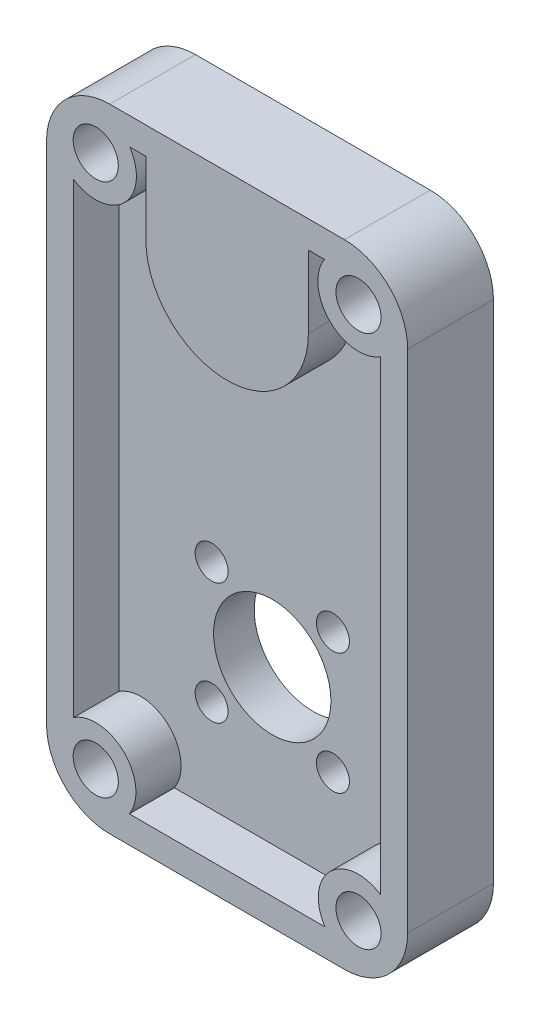
from build123d import *

# Parameters (mm, degrees)
SKETCH1_W           = 40
SKETCH1_H           = 70
SKETCH1_R           = 1.825
SKETCH1_R_2         = 6.5
BOSS_EXTRUDE1_DEPTH = 4.5
SKETCH3_W           = 40
SKETCH3_H           = 70
BOSS_EXTRUDE2_DEPTH = 5
SKETCH6_R           = 2.5
CUT_EXTRUDE3_DEPTH  = 7
SKETCH4_R           = 7
CUT_EXTRUDE1_DEPTH  = 7.5
FILLET1_R           = 7
TEXT_2804_DEPTH     = 1


with BuildPart() as part:
    # Sketch1 → Boss-Extrude1 (new body)
    with BuildSketch(Plane.XY):
        with Locations((20, 35)):
            Rectangle(SKETCH1_W, SKETCH1_H)
        with Locations((26.717514421, 13.282485579)):
            Circle(SKETCH1_R, mode=Mode.SUBTRACT)
        with Locations((26.717514421, 26.717514421)):
            Circle(SKETCH1_R, mode=Mode.SUBTRACT)
        with Locations((13.282485579, 26.717514421)):
            Circle(SKETCH1_R, mode=Mode.SUBTRACT)
        with Locations((13.282485579, 13.282485579)):
            Circle(SKETCH1_R, mode=Mode.SUBTRACT)
        with Locations((20, 20)):
            Circle(SKETCH1_R_2, mode=Mode.SUBTRACT)
    extrude(amount=BOSS_EXTRUDE1_DEPTH)

    # Sketch3 → Boss-Extrude2 (add)
    with BuildSketch(Plane.XY.offset(4.5)):
        with Locations((20, 35)):
            Rectangle(SKETCH3_W, SKETCH3_H)
        with BuildLine():
            Line((9.164835124, 3), (30.835164876, 3))
            ThreePointArc((30.835164876, 3), (31.403374824, 8.596625176), (37, 9.164835124))
            Line((37, 9.164835124), (37, 60.77541393))
            ThreePointArc((37, 60.77541393), (31.368019485, 61.368019485), (30.77541393, 67))
            Line((30.77541393, 67), (29, 67))
            Line((29, 67), (29, 59))
            ThreePointArc((29, 59), (20, 50), (11, 59))
            Line((11, 59), (11, 67))
            Line((11, 67), (9.22458607, 67))
            ThreePointArc((9.22458607, 67), (8.631980515, 61.368019485), (3, 60.77541393))
            Line((3, 60.77541393), (3, 9.164835124))
            ThreePointArc((3, 9.164835124), (8.596625176, 8.596625176), (9.164835124, 3))
        make_face(mode=Mode.SUBTRACT)
    extrude(amount=BOSS_EXTRUDE2_DEPTH)

    # Sketch6 → Cut-Extrude3 (cut)
    with BuildSketch(Plane.XY.offset(9.5)):
        with Locations((5.45, 64.55)):
            Circle(SKETCH6_R)
        with Locations((5.45, 5.45)):
            Circle(SKETCH6_R)
        with Locations((34.55, 5.45)):
            Circle(SKETCH6_R)
        with Locations((34.55, 64.55)):
            Circle(SKETCH6_R)
    extrude(amount=-CUT_EXTRUDE3_DEPTH, mode=Mode.SUBTRACT)

    # Sketch4 → Cut-Extrude1 (cut)
    with BuildSketch(Plane(origin=(0, 0, 0), x_dir=(-1, 0, 0), z_dir=(0, 0, -1))):
        with Locations((-20, 59)):
            Circle(SKETCH4_R)
    extrude(amount=-CUT_EXTRUDE1_DEPTH, mode=Mode.SUBTRACT)

    # Fillet1
    fillet1_edges = [part.edges().sort_by_distance(p)[0] for p in [
        (0, 70, 4.75),
        (40, 70, 4.75),
        (40, 0, 4.75),
        (0, 0, 4.75),
    ]]
    fillet(fillet1_edges, radius=FILLET1_R)

    # Sketch9 → Text-2804 (cut)
    # profile 1 of 4: a face of its own
    with BuildSketch(Plane(origin=(0, 0, 0), x_dir=(-1, 0, 0), z_dir=(0, 0, -1))):
        with BuildLine():
            Line((-11.980426125, 44.596523498), (-10.914320356, 44.286427345))
            add(Edge.make_bspline(
                [(-10.914320356, 44.286427345), (-10.941121501, 44.212201398), (-10.993377806, 44.067477224), (-11.090992823, 43.863360404), (-11.198202606, 43.675175785), (-11.319635477, 43.504666634), (-11.451335999, 43.349843442), (-11.597197903, 43.213418702), (-11.753396357, 43.092191437), (-11.922094381, 42.990509858), (-12.098142142, 42.906636666), (-12.279978738, 42.840895291), (-12.466472117, 42.794846874), (-12.658355143, 42.77029452), (-12.854390813, 42.762290422), (-13.055534714, 42.77678538), (-13.261286477, 42.8084484), (-13.397775761, 42.844839195), (-13.467204971, 42.863350421)],
                knots=[0, 0, 0, 0, 1.15750011, 2.25686912, 3.315794148, 4.332157814, 5.324478525, 6.29362271, 7.257957216, 8.220946452, 9.17824685, 10.115604155, 11.053938287, 11.991092726, 12.950124948, 13.928287594, 14.946163745, 16, 16, 16, 16], degree=3))
            add(Edge.make_bspline(
                [(-13.467204971, 42.863350421), (-13.551282692, 42.890632494), (-13.715534034, 42.943929814), (-13.944579077, 43.055404246), (-14.149072169, 43.19130747), (-14.331226731, 43.34746937), (-14.485491351, 43.526929537), (-14.614473349, 43.724787633), (-14.715993262, 43.941620294), (-14.787672851, 44.173161712), (-14.832596499, 44.409991215), (-14.845666141, 44.64421054), (-14.830715423, 44.872319464), (-14.795061628, 45.017963224), (-14.777301125, 45.090513883)],
                knots=[0, 0, 0, 0, 1.10520375, 2.159088023, 3.175577343, 4.170761846, 5.151802116, 6.126634874, 7.117985331, 8.137585756, 9.15240449, 10.126618192, 11.066797751, 12, 12, 12, 12], degree=3))
            add(Edge.make_bspline(
                [(-14.777301125, 45.090513883), (-14.763794427, 45.133156964), (-14.736334784, 45.219852012), (-14.684867349, 45.348348493), (-14.621207088, 45.475468904), (-14.55116938, 45.603726442), (-14.467789297, 45.729425349), (-14.378729371, 45.857589017), (-14.276712372, 45.983353663), (-14.165629164, 46.110773523), (-14.040816295, 46.239582325), (-13.898570574, 46.368436085), (-13.740265279, 46.501209968), (-13.565691194, 46.6368378), (-13.371906844, 46.772030657), (-13.16291963, 46.912030694), (-12.935968893, 47.05312752), (-12.777902225, 47.146139538), (-12.696772279, 47.193879268)],
                knots=[0, 0, 0, 0, 0.708317974, 1.440038062, 2.189212932, 2.958983779, 3.752754562, 4.576690561, 5.42991451, 6.315736775, 7.253574803, 8.268584018, 9.354000461, 10.525476643, 11.768393432, 13.095334037, 14.509139227, 16, 16, 16, 16], degree=3))
            Line((-12.696772279, 47.193879268), (-11.855426125, 47.685465806))
            Line((-11.855426125, 47.685465806), (-13.902301125, 48.280417729))
            Line((-13.902301125, 48.280417729), (-13.607829971, 49.29243696))
            Line((-13.607829971, 49.29243696), (-9.62706074, 48.13618696))
            Line((-9.62706074, 48.13618696), (-9.779704971, 47.612148498))
            Line((-9.779704971, 47.612148498), (-12.08379151, 46.315273498))
            add(Edge.make_bspline(
                [(-12.08379151, 46.315273498), (-12.150862381, 46.277496275), (-12.280077296, 46.204716832), (-12.464670632, 46.094680163), (-12.633964003, 45.989783912), (-12.787028209, 45.887450556), (-12.923882704, 45.788918368), (-13.045990625, 45.695482436), (-13.151769739, 45.605466046), (-13.269703734, 45.494265722), (-13.392584927, 45.357218894), (-13.513926046, 45.192174314), (-13.608670789, 45.028843715), (-13.647916043, 44.91534193), (-13.666724202, 44.860946575)],
                knots=[0, 0, 0, 0, 1.259574916, 2.426625201, 3.516256558, 4.518121287, 5.438744464, 6.275353076, 7.03336827, 7.710431516, 8.926712404, 10.038676673, 11.060042284, 12, 12, 12, 12], degree=3))
            add(Edge.make_bspline(
                [(-13.666724202, 44.860946575), (-13.679855555, 44.807192639), (-13.705386356, 44.702680856), (-13.704335385, 44.542747893), (-13.672781872, 44.389330911), (-13.609525549, 44.245457588), (-13.520493515, 44.114170955), (-13.401129436, 44.008130344), (-13.262217189, 43.918860263), (-13.155759648, 43.883875256), (-13.100618433, 43.865754268)],
                knots=[0, 0, 0, 0, 1.03274823, 2.007934041, 2.965681801, 3.946735693, 4.933080945, 5.909996321, 6.91745252, 8, 8, 8, 8], degree=3))
            add(Edge.make_bspline(
                [(-13.100618433, 43.865754268), (-13.071483959, 43.858415198), (-13.014479284, 43.844055533), (-12.927951069, 43.831745064), (-12.842848872, 43.829145682), (-12.758728528, 43.836951587), (-12.675925399, 43.852005672), (-12.594512064, 43.877731533), (-12.515157851, 43.913149761), (-12.436614209, 43.956212849), (-12.361795848, 44.008730195), (-12.291194923, 44.069409801), (-12.226606555, 44.138372722), (-12.165761781, 44.214137914), (-12.112208254, 44.298969091), (-12.06253528, 44.390800912), (-12.018155298, 44.49054621), (-11.993183848, 44.560688393), (-11.980426125, 44.596523498)],
                knots=[0, 0, 0, 0, 0.965972929, 1.890028075, 2.805414934, 3.698019178, 4.602912844, 5.507806509, 6.436880808, 7.394478216, 8.384817574, 9.371712848, 10.383619914, 11.420175661, 12.492642758, 13.605542803, 14.776690119, 16, 16, 16, 16], degree=3))
        make_face()
    # profile 2 of 4: a face of its own
    with BuildSketch(Plane(origin=(0, 0, 0), x_dir=(-1, 0, 0), z_dir=(0, 0, -1))):
        with BuildLine():
            add(Edge.make_bspline(
                [(-18.783087428, 46.617524783), (-18.844596566, 46.667271228), (-18.966158099, 46.765585953), (-19.122374982, 46.938618813), (-19.25693988, 47.126036683), (-19.362847951, 47.330571652), (-19.443852654, 47.546028679), (-19.496856116, 47.76926962), (-19.522133321, 47.999223628), (-19.515841321, 48.153549218), (-19.512654735, 48.231707475)],
                knots=[0, 0, 0, 0, 1.025676287, 2.02706108, 3.015679677, 4.013776418, 5.007921307, 5.99703238, 6.985596243, 8, 8, 8, 8], degree=3))
            add(Edge.make_bspline(
                [(-19.512654735, 48.231707475), (-19.502787918, 48.315814302), (-19.483228002, 48.48254714), (-19.416173969, 48.724787727), (-19.316251228, 48.954029868), (-19.208331806, 49.133069658), (-19.108006125, 49.266727122), (-19.027378785, 49.360762934), (-18.941882708, 49.447568255), (-18.851492926, 49.527062329), (-18.756197426, 49.599842374), (-18.655255557, 49.66411091), (-18.55002504, 49.722674454), (-18.439019072, 49.773058043), (-18.321796171, 49.81663943), (-18.19797037, 49.852272296), (-18.067643932, 49.881627087), (-17.930173769, 49.901435596), (-17.785741738, 49.91468489), (-17.634111263, 49.920303525), (-17.475631293, 49.919699343), (-17.36799765, 49.912208394), (-17.313135505, 49.908390168)],
                knots=[0, 0, 0, 0, 1.627592792, 3.226529578, 4.814652536, 6.426175198, 7.235569521, 8.028198545, 8.807674124, 9.577793203, 10.342492112, 11.112263899, 11.878205086, 12.657795005, 13.455356522, 14.282326322, 15.135154544, 16.023642682, 16.952543013, 17.924580634, 18.942134124, 20, 20, 20, 20], degree=3))
            add(Edge.make_bspline(
                [(-17.313135505, 49.908390168), (-17.254589972, 49.903278255), (-17.140439909, 49.893311223), (-16.974778071, 49.870501038), (-16.818793817, 49.841501676), (-16.672530272, 49.807388556), (-16.536087217, 49.765655025), (-16.408396853, 49.721318686), (-16.291334204, 49.667883378), (-16.149213641, 49.589575956), (-15.986310116, 49.476069434), (-15.815474003, 49.311478788), (-15.667431237, 49.122333793), (-15.566516926, 48.945443521), (-15.498213803, 48.795075532), (-15.454586447, 48.677859647), (-15.419939715, 48.557685167), (-15.393131867, 48.434431656), (-15.37579736, 48.308222793), (-15.364097652, 48.179071661), (-15.363531704, 48.046912029), (-15.368380444, 47.958050232), (-15.370827812, 47.91319786)],
                knots=[0, 0, 0, 0, 1.116502697, 2.176918536, 3.175763586, 4.130348813, 5.02863968, 5.885833455, 6.696648189, 7.470043099, 8.967377309, 10.453367913, 11.960922953, 13.516026044, 14.309831439, 15.097444153, 15.890044128, 16.684360361, 17.491773186, 18.309172061, 19.146566384, 20, 20, 20, 20], degree=3))
            add(Edge.make_bspline(
                [(-15.370827812, 47.91319786), (-15.378937425, 47.836764666), (-15.394908972, 47.686232645), (-15.45153668, 47.468199397), (-15.532590492, 47.262554423), (-15.637459586, 47.068543704), (-15.769035726, 46.888483814), (-15.924260546, 46.720405225), (-16.104276242, 46.56399147), (-16.239151897, 46.473852174), (-16.308327812, 46.427620937)],
                knots=[0, 0, 0, 0, 1.008718932, 1.986630312, 2.948444049, 3.907083857, 4.875729233, 5.870341448, 6.907726681, 8, 8, 8, 8], degree=3))
            add(Edge.make_bspline(
                [(-16.308327812, 46.427620937), (-16.268896492, 46.379055482), (-16.191822891, 46.284128035), (-16.094517936, 46.132023549), (-16.011558375, 45.978410777), (-15.947878246, 45.820155067), (-15.900905733, 45.659047656), (-15.868581182, 45.495454554), (-15.856949439, 45.328371737), (-15.861385125, 45.216876237), (-15.863616274, 45.160794014)],
                knots=[0, 0, 0, 0, 1.088549053, 2.127709526, 3.13890582, 4.124804186, 5.091760375, 6.057759704, 7.023053373, 8, 8, 8, 8], degree=3))
            add(Edge.make_bspline(
                [(-15.863616274, 45.160794014), (-15.871921016, 45.084703452), (-15.888262407, 44.934978678), (-15.949035952, 44.718734784), (-16.036016168, 44.514893908), (-16.149955039, 44.325786711), (-16.287500652, 44.154101067), (-16.447008654, 44.00330183), (-16.629966162, 43.878157985), (-16.830539598, 43.774211293), (-17.04943666, 43.697402949), (-17.282857763, 43.648149036), (-17.530023554, 43.627694688), (-17.69815212, 43.635275516), (-17.784289351, 43.639159399)],
                knots=[0, 0, 0, 0, 1.001833004, 1.971324914, 2.931140457, 3.899266123, 4.855512497, 5.806553983, 6.765047031, 7.751457337, 8.759601248, 9.795708569, 10.870676387, 12, 12, 12, 12], degree=3))
            add(Edge.make_bspline(
                [(-17.784289351, 43.639159399), (-17.869161391, 43.648327992), (-18.034205291, 43.666157427), (-18.271018715, 43.726495969), (-18.49024023, 43.81030049), (-18.690951929, 43.920071283), (-18.870698007, 44.053514161), (-19.027661559, 44.209998886), (-19.163340055, 44.386011025), (-19.273025396, 44.581961185), (-19.357216285, 44.790424631), (-19.412421433, 45.006640022), (-19.440754329, 45.228206197), (-19.435021056, 45.376682417), (-19.432125889, 45.451659399)],
                knots=[0, 0, 0, 0, 1.120901751, 2.179728407, 3.201703717, 4.198623705, 5.177082304, 6.134091021, 7.10312266, 8.088796305, 9.076479596, 10.049751844, 11.015170783, 12, 12, 12, 12], degree=3))
            add(Edge.make_bspline(
                [(-19.432125889, 45.451659399), (-19.426807599, 45.504302023), (-19.416366525, 45.60765207), (-19.382093311, 45.758482531), (-19.332306824, 45.901466479), (-19.268828346, 46.041333507), (-19.183361236, 46.180168014), (-19.072472743, 46.321133377), (-18.9383739, 46.469784975), (-18.836677534, 46.566539067), (-18.783087428, 46.617524783)],
                knots=[0, 0, 0, 0, 0.925307639, 1.81659993, 2.699079127, 3.571220189, 4.499524634, 5.544304658, 6.705942219, 8, 8, 8, 8], degree=3))
        make_face()
        with BuildLine():
            add(Edge.make_bspline(
                [(-17.66289512, 44.732909399), (-17.617916033, 44.731482347), (-17.530722953, 44.728715973), (-17.404127442, 44.75497981), (-17.288499368, 44.80505915), (-17.186522211, 44.879223276), (-17.099446572, 44.971315778), (-17.033585102, 45.081298113), (-16.987660948, 45.205247563), (-16.977172742, 45.2942152), (-16.971789351, 45.339880552)],
                knots=[0, 0, 0, 0, 1.045858946, 2.027423624, 2.985022703, 3.961957333, 4.946316159, 5.918374474, 6.931542218, 8, 8, 8, 8], degree=3))
            add(Edge.make_bspline(
                [(-16.971789351, 45.339880552), (-16.970277746, 45.386474998), (-16.967329935, 45.477339738), (-16.995168533, 45.609378068), (-17.04635842, 45.731503899), (-17.122474938, 45.839576376), (-17.215616607, 45.933045961), (-17.325497344, 46.003598607), (-17.448778508, 46.051126613), (-17.536286844, 46.062442653), (-17.581164351, 46.068245937)],
                knots=[0, 0, 0, 0, 1.053737331, 2.054913795, 3.031770943, 4.037141782, 5.032739697, 6.005321923, 6.977055399, 8, 8, 8, 8], degree=3))
            add(Edge.make_bspline(
                [(-17.581164351, 46.068245937), (-17.627340447, 46.069735831), (-17.716984254, 46.07262823), (-17.847160746, 46.045437142), (-17.965350097, 45.991967089), (-18.070990471, 45.916285784), (-18.160670558, 45.820247097), (-18.22721218, 45.705276621), (-18.274936267, 45.575582271), (-18.285841318, 45.482130652), (-18.291500889, 45.433630552)],
                knots=[0, 0, 0, 0, 1.036304027, 2.011825273, 2.959694962, 3.934924839, 4.916917001, 5.890521945, 6.905210013, 8, 8, 8, 8], degree=3))
            add(Edge.make_bspline(
                [(-18.291500889, 45.433630552), (-18.293101248, 45.387415981), (-18.296194477, 45.298090869), (-18.267782252, 45.169137064), (-18.218684453, 45.050810271), (-18.142944087, 44.947366512), (-18.047934411, 44.860173026), (-17.934224014, 44.794439658), (-17.804687466, 44.748357006), (-17.711367013, 44.738190183), (-17.66289512, 44.732909399)],
                knots=[0, 0, 0, 0, 1.045647027, 2.021062505, 2.970189494, 3.934138375, 4.905987733, 5.875921276, 6.896725064, 8, 8, 8, 8], degree=3))
        make_face(mode=Mode.SUBTRACT)
        with BuildLine():
            add(Edge.make_bspline(
                [(-17.523472043, 47.129544014), (-17.489828965, 47.127850565), (-17.42374279, 47.12452407), (-17.325996964, 47.128012974), (-17.231849538, 47.140005321), (-17.141187418, 47.160292739), (-17.054264941, 47.189915178), (-16.969960166, 47.225153838), (-16.88986627, 47.270695432), (-16.813869443, 47.322952862), (-16.743394506, 47.380858044), (-16.68184526, 47.444416898), (-16.626971205, 47.509867536), (-16.582769695, 47.580828727), (-16.54426128, 47.654128567), (-16.517534051, 47.732556051), (-16.497408975, 47.813786509), (-16.491570788, 47.869419057), (-16.488616274, 47.89757286)],
                knots=[0, 0, 0, 0, 1.127992943, 2.215752691, 3.271074808, 4.30310157, 5.321602761, 6.343634295, 7.359036366, 8.401308114, 9.430538998, 10.407985493, 11.361650809, 12.284899184, 13.203159897, 14.1284542, 15.05287223, 16, 16, 16, 16], degree=3))
            add(Edge.make_bspline(
                [(-16.488616274, 47.89757286), (-16.487202217, 47.927219715), (-16.484428567, 47.985371563), (-16.490801336, 48.071581736), (-16.505195944, 48.15493828), (-16.527902558, 48.235625979), (-16.559703117, 48.313222826), (-16.59941843, 48.388495043), (-16.649031617, 48.459977299), (-16.705371954, 48.528662729), (-16.768711748, 48.592180592), (-16.838816931, 48.648979959), (-16.91500195, 48.698394723), (-16.996601292, 48.740658073), (-17.084746123, 48.774196802), (-17.177776249, 48.802030491), (-17.277271831, 48.821248442), (-17.345517469, 48.828007858), (-17.380443197, 48.831467091)],
                knots=[0, 0, 0, 0, 0.9856407, 1.933319012, 2.865816895, 3.793071969, 4.712840543, 5.647996203, 6.6155752, 7.599235434, 8.59720941, 9.59117848, 10.591990639, 11.610275202, 12.638866288, 13.721614837, 14.834002235, 16, 16, 16, 16], degree=3))
            add(Edge.make_bspline(
                [(-17.380443197, 48.831467091), (-17.41568659, 48.833696894), (-17.484558131, 48.838054305), (-17.58585684, 48.833903121), (-17.682299231, 48.823298261), (-17.774211935, 48.80561014), (-17.861241689, 48.779062217), (-17.942986227, 48.744278336), (-18.019507492, 48.701366627), (-18.091179517, 48.652868365), (-18.156505654, 48.597275828), (-18.213923578, 48.53621696), (-18.263748654, 48.470480829), (-18.30662686, 48.400429492), (-18.339872038, 48.324115767), (-18.366063568, 48.243570533), (-18.386301697, 48.158427817), (-18.391963602, 48.099604586), (-18.394866274, 48.06944786)],
                knots=[0, 0, 0, 0, 1.187021055, 2.319639539, 3.404436782, 4.448289858, 5.462767506, 6.458912702, 7.430045305, 8.409277414, 9.365145316, 10.30887381, 11.222492159, 12.135315194, 13.064306114, 14.014553736, 14.982127349, 16, 16, 16, 16], degree=3))
            add(Edge.make_bspline(
                [(-18.394866274, 48.06944786), (-18.396288084, 48.039395254), (-18.39909654, 47.980033332), (-18.392477139, 47.891907146), (-18.379119171, 47.806535491), (-18.353359532, 47.725074516), (-18.32359094, 47.645541061), (-18.281308291, 47.570493057), (-18.231825738, 47.498138158), (-18.174876424, 47.428734646), (-18.110074166, 47.365979393), (-18.04115595, 47.308413736), (-17.966657868, 47.259081214), (-17.886872325, 47.218566161), (-17.803019224, 47.184122793), (-17.714289523, 47.158422224), (-17.620797305, 47.138112646), (-17.556426151, 47.132445333), (-17.523472043, 47.129544014)],
                knots=[0, 0, 0, 0, 1.008212757, 1.991489456, 2.959123065, 3.898730799, 4.851980945, 5.802195254, 6.778745622, 7.790445004, 8.807218717, 9.799999427, 10.798855018, 11.796534794, 12.797196636, 13.834628766, 14.891461888, 16, 16, 16, 16], degree=3))
        make_face(mode=Mode.SUBTRACT)
    # profile 3 of 4: a face of its own
    with BuildSketch(Plane(origin=(0, 0, 0), x_dir=(-1, 0, 0), z_dir=(0, 0, -1))):
        with BuildLine():
            add(Edge.make_bspline(
                [(-22.508368551, 43.654552902), (-22.562018127, 43.650041817), (-22.667600336, 43.641164017), (-22.82426772, 43.643589438), (-22.976532082, 43.653603013), (-23.123855197, 43.675621175), (-23.267245945, 43.706354829), (-23.404825127, 43.750021994), (-23.538333104, 43.80319136), (-23.666750608, 43.866729105), (-23.79031335, 43.941270794), (-23.90641751, 44.028975517), (-24.019801156, 44.12478674), (-24.124349447, 44.234891478), (-24.225316178, 44.354191056), (-24.31845717, 44.486031043), (-24.407638585, 44.627794597), (-24.491191625, 44.781722753), (-24.568682833, 44.949631307), (-24.637739583, 45.134345309), (-24.701447452, 45.335741677), (-24.758813072, 45.553948551), (-24.808779259, 45.789123942), (-24.85352336, 46.040781431), (-24.890246481, 46.309513545), (-24.90952965, 46.49463844), (-24.919426243, 46.589649055)],
                knots=[0, 0, 0, 0, 0.898595029, 1.768432395, 2.61362849, 3.44536978, 4.253829314, 5.06009861, 5.852788901, 6.651723381, 7.450377641, 8.258643343, 9.079440191, 9.926435253, 10.790825837, 11.687625569, 12.61955435, 13.586609137, 14.610485429, 15.705274311, 16.877569277, 18.136944594, 19.471582241, 20.891716018, 22.404752787, 24, 24, 24, 24], degree=3))
            add(Edge.make_bspline(
                [(-24.919426243, 46.589649055), (-24.927651715, 46.686159771), (-24.943609927, 46.873399914), (-24.956784078, 47.147201708), (-24.960718858, 47.405371013), (-24.955084933, 47.647983312), (-24.939630291, 47.87459499), (-24.915128106, 48.085823454), (-24.878996831, 48.2811664), (-24.834640889, 48.461870309), (-24.78103797, 48.628944137), (-24.721173361, 48.785028701), (-24.654933494, 48.931318572), (-24.582369919, 49.067269829), (-24.500869255, 49.191506242), (-24.414724854, 49.306086863), (-24.321520931, 49.410313997), (-24.22140134, 49.504428164), (-24.113855933, 49.58925085), (-23.997923011, 49.664025399), (-23.873332156, 49.72892251), (-23.74098257, 49.78513166), (-23.601028368, 49.833712707), (-23.452674412, 49.871908531), (-23.295974467, 49.90078831), (-23.188347633, 49.912826502), (-23.133368551, 49.918975978)],
                knots=[0, 0, 0, 0, 1.625012898, 3.152682512, 4.598039118, 5.956285788, 7.22302717, 8.407805075, 9.521883341, 10.553869966, 11.527506854, 12.463763993, 13.357199875, 14.220386307, 15.046336746, 15.847601491, 16.623541036, 17.389163181, 18.15028685, 18.918471927, 19.700212971, 20.50429234, 21.329093153, 22.183413744, 23.072032131, 24, 24, 24, 24], degree=3))
            add(Edge.make_bspline(
                [(-23.133368551, 49.918975978), (-23.078115303, 49.923375056), (-22.970123161, 49.931973027), (-22.810295453, 49.931245436), (-22.656067474, 49.922221809), (-22.507301755, 49.90209203), (-22.364803456, 49.870430288), (-22.227997923, 49.829625289), (-22.096748566, 49.778061949), (-21.971669662, 49.715054043), (-21.851249383, 49.642798697), (-21.737616922, 49.557901524), (-21.627573553, 49.464361112), (-21.52369263, 49.358786587), (-21.425668809, 49.24237007), (-21.332706629, 49.115345935), (-21.245104512, 48.977896113), (-21.161246613, 48.829218099), (-21.083892746, 48.666026301), (-21.01451418, 48.48580388), (-20.951344724, 48.288627384), (-20.893351668, 48.07418678), (-20.843689898, 47.841714797), (-20.799035405, 47.591646142), (-20.762219917, 47.323722411), (-20.743008832, 47.138988509), (-20.733128167, 47.043975978)],
                knots=[0, 0, 0, 0, 0.936544566, 1.830470748, 2.69899965, 3.54660351, 4.364887689, 5.164032214, 5.957561564, 6.744999026, 7.528963405, 8.32810793, 9.139779887, 9.968229476, 10.82840146, 11.710188711, 12.626936177, 13.58202798, 14.593804392, 15.67661032, 16.843802864, 18.092308569, 19.42992748, 20.860651162, 22.385366861, 24, 24, 24, 24], degree=3))
            add(Edge.make_bspline(
                [(-20.733128167, 47.043975978), (-20.721845286, 46.911447475), (-20.70008888, 46.655897157), (-20.689055701, 46.284776275), (-20.69747654, 45.940572451), (-20.721299361, 45.622488209), (-20.764760757, 45.330854752), (-20.828701724, 45.066417969), (-20.908160208, 44.827144878), (-20.980658178, 44.683081924), (-21.01558009, 44.613687517)],
                knots=[0, 0, 0, 0, 1.287086814, 2.481846835, 3.591125625, 4.618002148, 5.567245668, 6.440917259, 7.248997609, 8, 8, 8, 8], degree=3))
            add(Edge.make_bspline(
                [(-21.01558009, 44.613687517), (-21.057194064, 44.54444888), (-21.138466914, 44.40922456), (-21.286428972, 44.228656113), (-21.449089489, 44.070710526), (-21.6296912, 43.937891665), (-21.825682613, 43.828401136), (-22.038738412, 43.745914565), (-22.267179765, 43.684295565), (-22.426684851, 43.664625886), (-22.508368551, 43.654552902)],
                knots=[0, 0, 0, 0, 1.046185749, 2.043219849, 3.016743662, 3.978780724, 4.941420607, 5.918554661, 6.934076893, 8, 8, 8, 8], degree=3))
        make_face()
        with BuildLine():
            add(Edge.make_bspline(
                [(-22.639378167, 44.730274055), (-22.592540661, 44.737051699), (-22.500454755, 44.750377034), (-22.369404196, 44.798539353), (-22.250211194, 44.870045264), (-22.159514003, 44.945756633), (-22.094131261, 45.018993135), (-22.048652797, 45.082681867), (-22.007720383, 45.154566087), (-21.970226407, 45.233948304), (-21.938471514, 45.321969727), (-21.909491726, 45.417420505), (-21.884080245, 45.520849508), (-21.864179903, 45.633740262), (-21.84655337, 45.756692752), (-21.837120668, 45.891625437), (-21.828904642, 46.038664994), (-21.82910489, 46.198635909), (-21.830554431, 46.37138806), (-21.839880082, 46.55690573), (-21.852802743, 46.754875602), (-21.865044173, 46.890953932), (-21.87134932, 46.961043286)],
                knots=[0, 0, 0, 0, 1.079335957, 2.122052119, 3.164687883, 4.24320803, 4.807386379, 5.404481893, 6.027950606, 6.695570773, 7.408195276, 8.164144741, 8.974678373, 9.840276468, 10.782923381, 11.811678028, 12.930035203, 14.147790517, 15.466352327, 16.877800793, 18.391860568, 20, 20, 20, 20], degree=3))
            add(Edge.make_bspline(
                [(-21.87134932, 46.961043286), (-21.880777212, 47.051653752), (-21.898877701, 47.225615629), (-21.934270156, 47.474813415), (-21.978122582, 47.700698836), (-22.024577867, 47.905254114), (-22.081305394, 48.085981728), (-22.141908313, 48.245385221), (-22.209800913, 48.381901027), (-22.28528365, 48.496733291), (-22.365734269, 48.592495246), (-22.448711198, 48.674544963), (-22.537157408, 48.740330795), (-22.627867454, 48.79501508), (-22.723516855, 48.832960919), (-22.822255614, 48.859117125), (-22.925271393, 48.870300311), (-22.99474878, 48.865913489), (-23.030003167, 48.863687517)],
                knots=[0, 0, 0, 0, 1.766536686, 3.391551239, 4.878688043, 6.227949323, 7.456604558, 8.548770518, 9.532050809, 10.406899237, 11.206668403, 11.953880778, 12.663982269, 13.339540529, 14.001743308, 14.65184941, 15.315918129, 16, 16, 16, 16], degree=3))
            add(Edge.make_bspline(
                [(-23.030003167, 48.863687517), (-23.063424463, 48.85937554), (-23.129196314, 48.850889731), (-23.224099856, 48.822783632), (-23.312229693, 48.781643918), (-23.393738094, 48.728313723), (-23.467564799, 48.661809585), (-23.536735597, 48.584781113), (-23.598153863, 48.493987011), (-23.631718918, 48.427006133), (-23.648993551, 48.392533671)],
                knots=[0, 0, 0, 0, 0.988284021, 1.944905677, 2.892223999, 3.835149785, 4.793505761, 5.801682904, 6.868611362, 8, 8, 8, 8], degree=3))
            add(Edge.make_bspline(
                [(-23.648993551, 48.392533671), (-23.668864177, 48.346036761), (-23.710685139, 48.248176459), (-23.754775925, 48.086132107), (-23.787967347, 47.9047613), (-23.81018224, 47.703924436), (-23.821698438, 47.483239163), (-23.822713203, 47.242582968), (-23.811488146, 46.981954563), (-23.796292581, 46.801941368), (-23.788416628, 46.70863944)],
                knots=[0, 0, 0, 0, 0.710252892, 1.494842642, 2.354391484, 3.30117566, 4.333557371, 5.460176676, 6.683594217, 8, 8, 8, 8], degree=3))
            add(Edge.make_bspline(
                [(-23.788416628, 46.70863944), (-23.778649366, 46.61441183), (-23.759908443, 46.433612715), (-23.722668117, 46.175007349), (-23.679790503, 45.939947427), (-23.630893358, 45.728033873), (-23.576492925, 45.539469548), (-23.515639217, 45.374220646), (-23.447313277, 45.233027262), (-23.373502034, 45.113410208), (-23.294586957, 45.013105322), (-23.21064488, 44.930337767), (-23.125714887, 44.858553706), (-23.034404232, 44.804959377), (-22.941225493, 44.762882074), (-22.843639176, 44.73582032), (-22.742128603, 44.725235774), (-22.673834257, 44.72858453), (-22.639378167, 44.730274055)],
                knots=[0, 0, 0, 0, 1.796183106, 3.446424211, 4.952868572, 6.32573714, 7.568603527, 8.672049745, 9.660766476, 10.537715658, 11.33264412, 12.073962738, 12.770444387, 13.434908509, 14.074364626, 14.704684862, 15.346483317, 16, 16, 16, 16], degree=3))
        make_face(mode=Mode.SUBTRACT)
    # profile 4 of 4: a face of its own
    with BuildSketch(Plane(origin=(0, 0, 0), x_dir=(-1, 0, 0), z_dir=(0, 0, -1))):
        Polygon((-27.314281899, 42.664211013), (-28.398416514, 42.33488409), (-29.511397284, 45.998345628), (-30.017406899, 45.844499474), (-30.322695361, 46.84690332), (-29.816685745, 47.000749474), (-30.171253053, 48.169018705), (-29.111156899, 48.49113409), (-28.756589591, 47.322864859), (-26.272214591, 48.077672551), (-25.96692613, 47.075268705), align=None)
        Polygon((-28.45130113, 46.320461013), (-27.871974207, 44.41300909), (-27.150820361, 46.715893705), align=None, mode=Mode.SUBTRACT)
    extrude(amount=-TEXT_2804_DEPTH, mode=Mode.SUBTRACT)


solid = part.part
